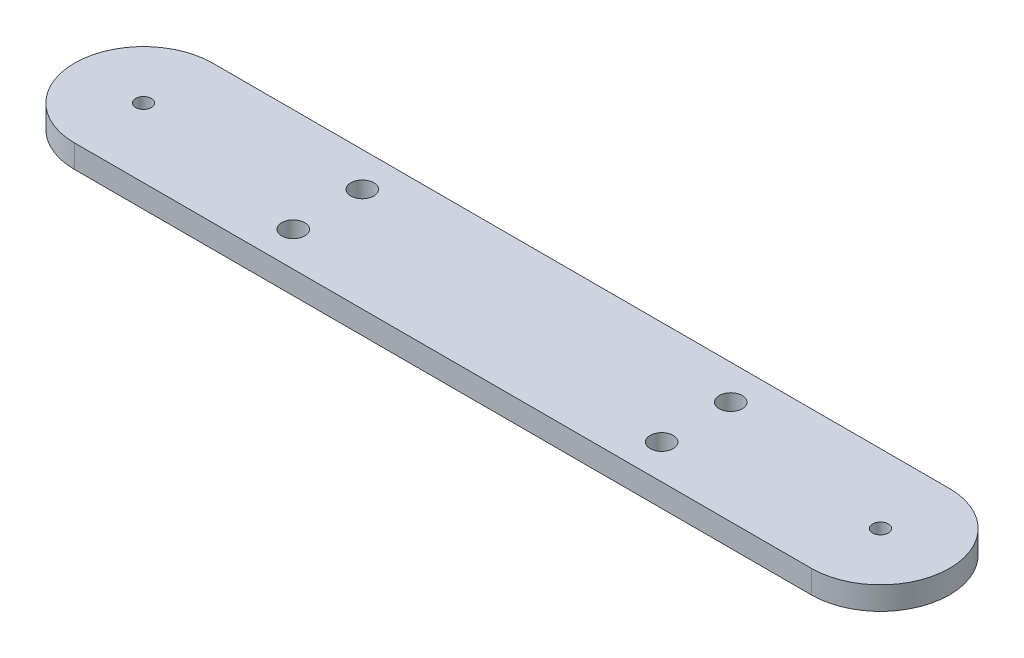
from build123d import *

# Parameters (mm, degrees)
SKETCH1_R           = 2.1828125
SKETCH1_R_2         = 3.175
BOSS_EXTRUDE1_DEPTH = 6.35


with BuildPart() as part:
    # Sketch1 → Boss-Extrude1 (new body)
    with BuildSketch(Plane(origin=(0, 0, 0), x_dir=(1, 0, 0), z_dir=(0, 1, 0))):
        with BuildLine():
            Line((0, 19.05), (203.2, 19.05))
            ThreePointArc((203.2, 19.05), (222.25, 0), (203.2, -19.05))
            Line((203.2, -19.05), (0, -19.05))
            ThreePointArc((0, -19.05), (-19.05, 0), (0, 19.05))
        make_face()
        with Locations(Location((0, 0, 0), (0, 0, 270))):
            Circle(SKETCH1_R, mode=Mode.SUBTRACT)
        with Locations(Location((203.2, 0, 0), (0, 0, 270))):
            Circle(SKETCH1_R, mode=Mode.SUBTRACT)
        with Locations(Location((50.8, 9.525, 0), (0, 0, 270))):
            Circle(SKETCH1_R_2, mode=Mode.SUBTRACT)
        with Locations(Location((152.4, 9.525, 0), (0, 0, 270))):
            Circle(SKETCH1_R_2, mode=Mode.SUBTRACT)
        with Locations(Location((152.4, -9.525, 0), (0, 0, 270))):
            Circle(SKETCH1_R_2, mode=Mode.SUBTRACT)
        with Locations(Location((50.8, -9.525, 0), (0, 0, 270))):
            Circle(SKETCH1_R_2, mode=Mode.SUBTRACT)
    extrude(amount=BOSS_EXTRUDE1_DEPTH)


solid = part.part
